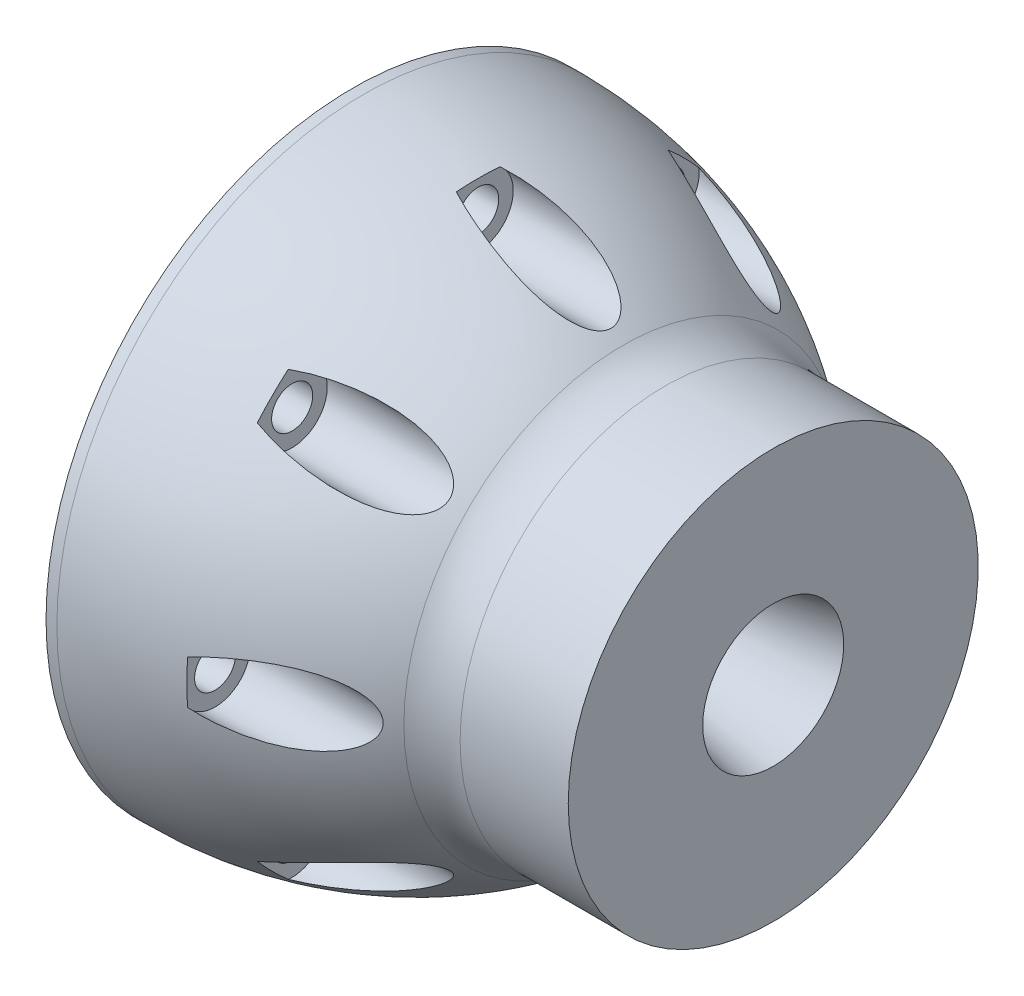
from build123d import *

# Parameters (mm, degrees)
CUT_EXTRUDE1_START = -12.7
SKETCH3_R          = 3.556
CUT_EXTRUDE1_DEPTH = 29.918152
SKETCH4_R          = 2.0828
CUT_EXTRUDE2_DEPTH = 12.7
CIRPATTERN1_COUNT  = 8


with BuildPart() as part:
    # Sketch2 → Revolve1 (revolve)
    with BuildSketch(Plane.XY, mode=Mode.PRIVATE) as revolve1_sk:
        with BuildLine():
            Line((61.871733, 7.1480426), (51.29041327, 5.055001066))
            ThreePointArc((51.29041327, 5.055001066), (51.046380141, 5.018882817), (50.8, 5.0064924))
            ThreePointArc((50.8, 5.0064924), (49.841678346, 5.196168991), (49.0299248, 5.7396888))
            Line((49.0299248, 5.7396888), (38.3808732, 16.3887404))
            ThreePointArc((38.3808732, 16.3887404), (35.432006503, 18.359111266), (31.953581, 19.051016))
            Line((31.953581, 19.051016), (25.603581, 19.051016))
            Line((25.603581, 19.051016), (25.603581, 22.225))
            Line((25.603581, 22.225), (19.253581, 22.225))
            Line((19.253581, 22.225), (19.253581, 31.115))
            Line((19.253581, 31.115), (20.351883229, 31.115))
            ThreePointArc((20.351883229, 31.115), (34.230433921, 28.832379737), (46.646836686, 22.225))
            ThreePointArc((46.646836686, 22.225), (48.658911913, 21.154275625), (50.907927879, 20.784377533))
            Line((50.907927879, 20.784377533), (61.871733, 20.784377533))
            Line((61.871733, 20.784377533), (61.871733, 7.1480426))
        make_face()
    revolve(revolve1_sk.sketch.rotate(Axis((0, 0, 0), (1, 0, 0)), 90), axis=Axis((0, 0, 0), (1, 0, 0)))

    # Sketch3 → Cut-Extrude1 (cut)
    with BuildSketch(Plane.ZY.offset(-19.253581).offset(CUT_EXTRUDE1_START)):
        with Locations((0, 26.67)):
            Circle(SKETCH3_R)
    cut_extrude1 = extrude(amount=-CUT_EXTRUDE1_DEPTH, mode=Mode.SUBTRACT)

    # Sketch4 → Cut-Extrude2 (cut)
    with BuildSketch(Plane(origin=(31.953581, 0, 0), x_dir=(0, 0, -1), z_dir=(1, 0, 0))):
        with Locations((0, 26.67)):
            Circle(SKETCH4_R)
    cut_extrude2 = extrude(amount=-CUT_EXTRUDE2_DEPTH, mode=Mode.SUBTRACT)

    # CirPattern1: Cut-Extrude1, Cut-Extrude2 ×8 about axis
    cirpattern1_axis = Axis((0, 0, 0), (1, 0, 0))
    add([cut_extrude1.rotate(cirpattern1_axis, i * 360 / CIRPATTERN1_COUNT) for i in range(1, CIRPATTERN1_COUNT)], mode=Mode.SUBTRACT)
    add([cut_extrude2.rotate(cirpattern1_axis, i * 360 / CIRPATTERN1_COUNT) for i in range(1, CIRPATTERN1_COUNT)], mode=Mode.SUBTRACT)


solid = part.part
